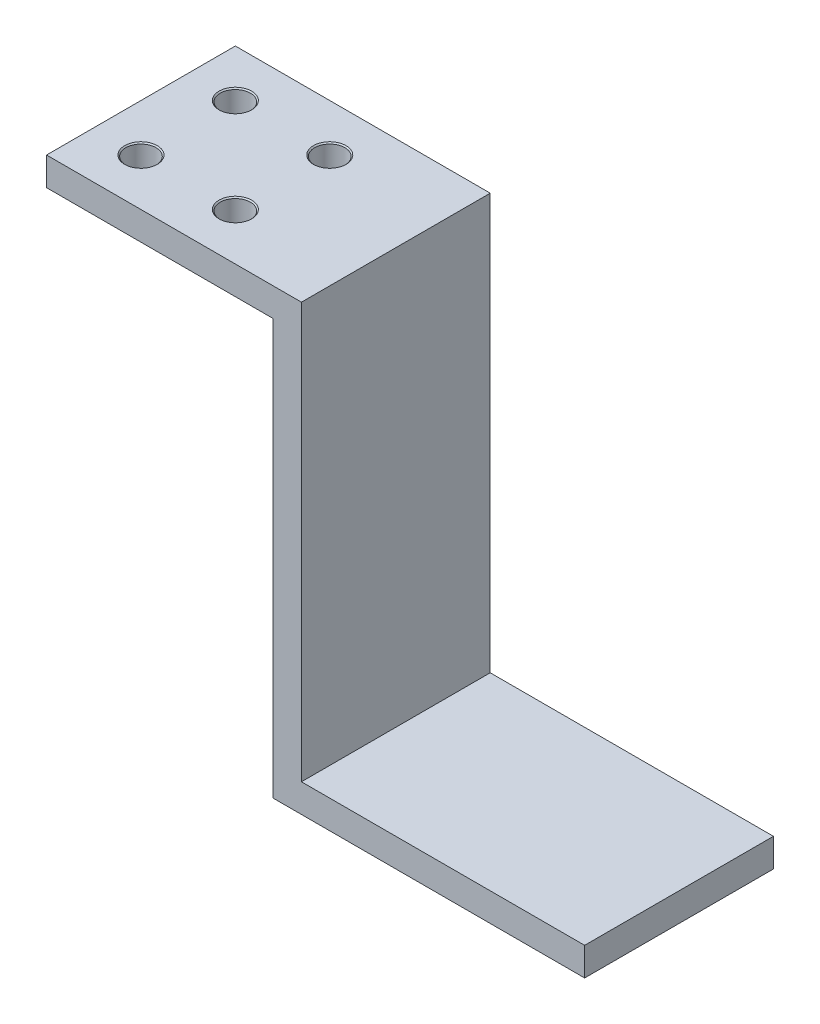
from build123d import *

# Parameters (mm, degrees)
BOSS_EXTRUDE1_DEPTH            = 20
M3_CLEARANCE_HOLE1_D           = 3.2
M3_CLEARANCE_HOLE1_CSINK_D     = 3.45
M3_CLEARANCE_HOLE1_CSINK_ANGLE = 90


with BuildPart() as part:
    # Sketch1 → Boss-Extrude1 (new body)
    with BuildSketch(Plane.XY):
        Polygon((0, 44), (24, 44), (24, 0), (57, 0), (57, 3), (27, 3), (27, 47), (0, 47), align=None)
    extrude(amount=BOSS_EXTRUDE1_DEPTH)

    # M3 Clearance Hole1 (through all)
    with Locations(Plane(origin=(0, 47, 0), x_dir=(1, 0, 0), z_dir=(0, 1, 0))):
        with Locations((15, -15), (5, -5), (5, -15), (15, -5)):
            CounterSinkHole(M3_CLEARANCE_HOLE1_D / 2, M3_CLEARANCE_HOLE1_CSINK_D / 2, counter_sink_angle=M3_CLEARANCE_HOLE1_CSINK_ANGLE)


solid = part.part
